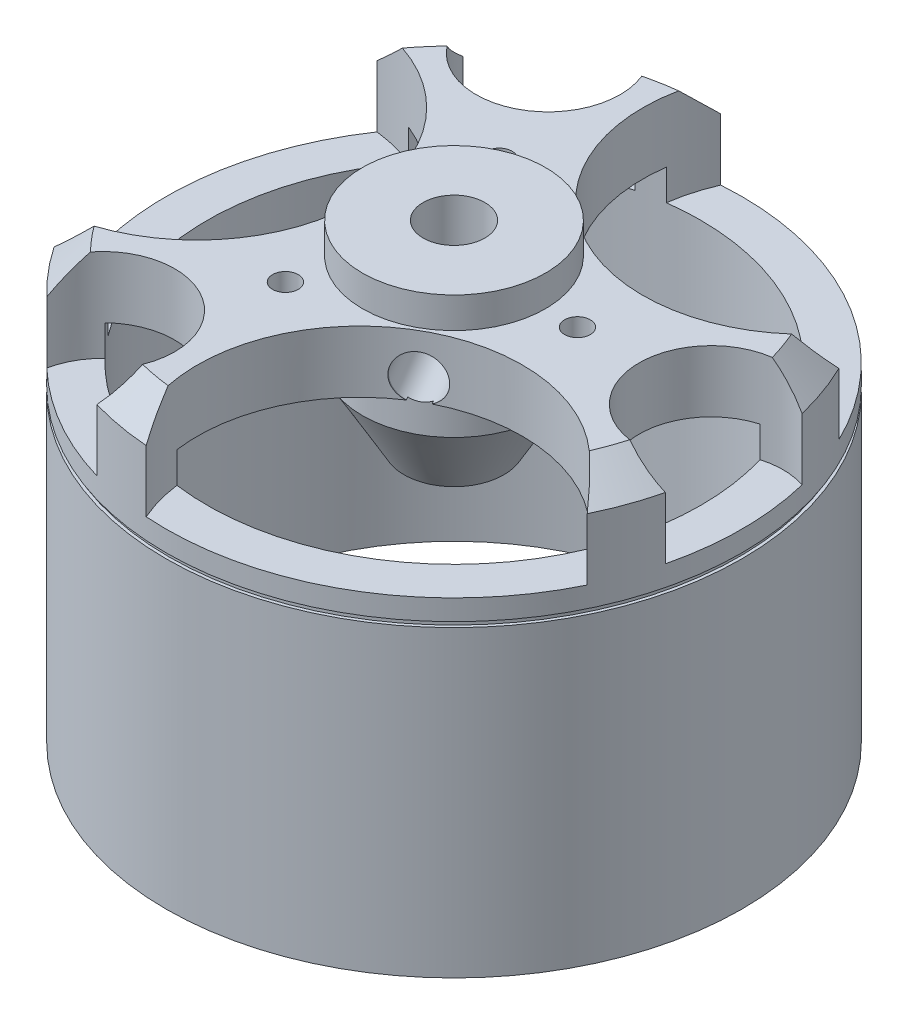
from build123d import *

# Parameters (mm, degrees)
SKETCH1_R                          = 14
BOSS_EXTRUDE1_DEPTH                = 20.5
SKETCH2_R                          = 12
CUT_EXTRUDE1_DEPTH                 = 17.5
CHAMFER1_SIZE                      = 1.5
SKETCH3_W                          = 0.15
SKETCH3_H                          = 0.25
BOSS_EXTRUDE2_DEPTH                = 1.5
BOSS_EXTRUDE2_DEPTH_BACK           = 4.5
SKETCH4_R                          = 4.45
SKETCH10_R                         = 4.45
BOSS_EXTRUDE3_DEPTH                = 3.5
BOSS_EXTRUDE3_TAPER                = 30
SKETCH5_R                          = 1.5
CUT_EXTRUDE2_DEPTH                 = 30.597297174
CUT_EXTRUDE3_START                 = -4.5
CUT_EXTRUDE3_DEPTH                 = 4.5
M1_6X0_35_TAPPED_HOLE1_D           = 1.25
M1_6X0_35_TAPPED_HOLE1_DEPTH       = 4.25
M1_6X0_35_TAPPED_HOLE1_TIP         = 0.375537887
M2_CLEARANCE_HOLE4_D               = 2.2
M2_CLEARANCE_HOLE4_DEPTH           = 3.5
M2_CLEARANCE_HOLE4_TIP             = 0.660946681
M2_CLEARANCE_HOLE4_ON_FACE_2_D     = 2.2
M2_CLEARANCE_HOLE4_ON_FACE_2_DEPTH = 3.5
M2_CLEARANCE_HOLE4_ON_FACE_2_TIP   = 0.660946681


with BuildPart() as part:
    # Sketch1 → Boss-Extrude1 (new body)
    with BuildSketch(Plane(origin=(0, 0, 0), x_dir=(1, 0, 0), z_dir=(0, 1, 0))):
        with Locations(Location((0, 0, 0), (0, 0, 270))):
            Circle(SKETCH1_R)
    extrude(amount=BOSS_EXTRUDE1_DEPTH)

    # Sketch2 → Cut-Extrude1 (cut)
    with BuildSketch(Plane.XZ):
        with Locations(Location((0, 0, 0), (0, 0, 270))):
            Circle(SKETCH2_R)
    extrude(amount=-CUT_EXTRUDE1_DEPTH, mode=Mode.SUBTRACT)

    # Chamfer1
    chamfer1_edges = [part.edges().sort_by_distance(p)[0] for p in [
        (0, 20.5, -14),
    ]]
    chamfer(chamfer1_edges, length=CHAMFER1_SIZE)

    # Sketch3 → Cut-Revolve1 (revolve, cut)
    with BuildSketch(Plane(origin=(0, 0, 0), x_dir=(0, 0, -1), z_dir=(1, 0, 0)), mode=Mode.PRIVATE) as cut_revolve1_sk:
        with Locations((13.925, 14.875)):
            Rectangle(SKETCH3_W, SKETCH3_H)
    revolve(cut_revolve1_sk.sketch.rotate(Axis((0, 20.5, 0), (0, -1, 0)), 180), axis=Axis((0, 20.5, 0), (0, -1, 0)), mode=Mode.SUBTRACT)

    # Sketch4 → Boss-Extrude2 (add, two sides: drawn at the far end of the back side and taken through both)
    with BuildSketch(Plane(origin=(0, 20.5, 0), x_dir=(1, 0, 0), z_dir=(0, 1, 0)).offset(-BOSS_EXTRUDE2_DEPTH_BACK)):
        with Locations(Location((0, 0, 0), (0, 0, 270))):
            Circle(SKETCH4_R)
    extrude(amount=BOSS_EXTRUDE2_DEPTH + BOSS_EXTRUDE2_DEPTH_BACK)

    # Sketch10 → Boss-Extrude3 (add)
    with BuildSketch(Plane.XZ.offset(-16)):
        with Locations(Location((0, 0, 0), (0, 0, 90))):
            Circle(SKETCH10_R)
    extrude(amount=BOSS_EXTRUDE3_DEPTH, taper=BOSS_EXTRUDE3_TAPER)

    # Sketch5 → Cut-Extrude2 (cut, through all)
    with BuildSketch(Plane(origin=(0, 22, 0), x_dir=(1, 0, 0), z_dir=(0, 1, 0))):
        with Locations(Location((0, 0, 0), (0, 0, 270))):
            Circle(SKETCH5_R)
    extrude(amount=-CUT_EXTRUDE2_DEPTH, mode=Mode.SUBTRACT)

    # Sketch6 → Cut-Extrude3 (cut)
    with BuildSketch(Plane(origin=(0, 20.5, 0), x_dir=(1, 0, 0), z_dir=(0, 1, 0)).offset(CUT_EXTRUDE3_START)):
        with BuildLine():
            ThreePointArc((-10.0036, -7.495197598), (-4.6, 0), (-10.0036, 7.495197598))
            ThreePointArc((-10.0036, 7.495197598), (-12.5, 0), (-10.0036, -7.495197598))
        make_face()
        with BuildLine():
            ThreePointArc((-10.0036, 7.495197598), (-10.789488556, 7.712596878), (-11.5936, 7.847830212))
            ThreePointArc((-11.5936, 7.847830212), (-14, 0), (-11.5936, -7.847830212))
            ThreePointArc((-11.5936, -7.847830212), (-10.789488556, -7.712596878), (-10.0036, -7.495197598))
            ThreePointArc((-10.0036, -7.495197598), (-12.5, 0), (-10.0036, 7.495197598))
        make_face()
        with BuildLine():
            ThreePointArc((-9.006237245, -8.668199968), (-6.25, -10.825317547), (-3.003762755, -12.133730231))
            ThreePointArc((-3.003762755, -12.133730231), (-4.5, -7.794228634), (-9.006237245, -8.668199968))
        make_face()
        with BuildLine():
            ThreePointArc((-9.677498914, -10.116620719), (-7, -12.124355653), (-3.922501086, -13.439270264))
            ThreePointArc((-3.922501086, -13.439270264), (-3.387703302, -12.839581088), (-3.003762755, -12.133730231))
            ThreePointArc((-3.003762755, -12.133730231), (-6.25, -10.825317547), (-9.006237245, -8.668199968))
            ThreePointArc((-9.006237245, -8.668199968), (-9.425551745, -9.353627664), (-9.677498914, -10.116620719))
        make_face()
        with BuildLine():
            ThreePointArc((-0.999620328, -13.964267227), (7, -12.124355653), (12.593220328, -6.116437015))
            ThreePointArc((12.593220328, -6.116437015), (12.074049103, -5.487672744), (11.492831527, -4.91577293))
            ThreePointArc((11.492831527, -4.91577293), (6.25, -10.825317547), (-1.489231527, -12.410970529))
            ThreePointArc((-1.489231527, -12.410970529), (-1.284560547, -13.200269622), (-0.999620328, -13.964267227))
        make_face()
        with BuildLine():
            ThreePointArc((-1.489231527, -12.410970529), (6.25, -10.825317547), (11.492831527, -4.91577293))
            ThreePointArc((11.492831527, -4.91577293), (2.3, -3.983716857), (-1.489231527, -12.410970529))
        make_face()
        with BuildLine():
            ThreePointArc((12.5, 0), (12.376893794, 1.75), (12.01, 3.465530262))
            ThreePointArc((12.01, 3.465530262), (9, 0), (12.01, -3.465530262))
            ThreePointArc((12.01, -3.465530262), (12.376893794, -1.75), (12.5, 0))
        make_face()
        with BuildLine():
            ThreePointArc((13.6, -3.322649545), (13.899640283, -1.673320053), (14, 0))
            ThreePointArc((14, 0), (13.899640283, 1.673320053), (13.6, 3.322649545))
            ThreePointArc((13.6, 3.322649545), (12.813255048, 3.485953424), (12.01, 3.465530262))
            ThreePointArc((12.01, 3.465530262), (12.376893794, 1.75), (12.5, 0))
            ThreePointArc((12.5, 0), (12.376893794, -1.75), (12.01, -3.465530262))
            ThreePointArc((12.01, -3.465530262), (12.813255048, -3.485953424), (13.6, -3.322649545))
        make_face()
        with BuildLine():
            ThreePointArc((11.492831527, 4.91577293), (12.074049103, 5.487672744), (12.593220328, 6.116437015))
            ThreePointArc((12.593220328, 6.116437015), (7, 12.124355653), (-0.999620328, 13.964267227))
            ThreePointArc((-0.999620328, 13.964267227), (-1.284560547, 13.200269622), (-1.489231527, 12.410970529))
            ThreePointArc((-1.489231527, 12.410970529), (6.25, 10.825317547), (11.492831527, 4.91577293))
        make_face()
        with BuildLine():
            ThreePointArc((-1.489231527, 12.410970529), (2.3, 3.983716857), (11.492831527, 4.91577293))
            ThreePointArc((11.492831527, 4.91577293), (6.25, 10.825317547), (-1.489231527, 12.410970529))
        make_face()
        with BuildLine():
            ThreePointArc((-9.006237245, 8.668199968), (-4.5, 7.794228634), (-3.003762755, 12.133730231))
            ThreePointArc((-3.003762755, 12.133730231), (-6.25, 10.825317547), (-9.006237245, 8.668199968))
        make_face()
        with BuildLine():
            ThreePointArc((-3.003762755, 12.133730231), (-3.387703302, 12.839581088), (-3.922501086, 13.439270264))
            ThreePointArc((-3.922501086, 13.439270264), (-7, 12.124355653), (-9.677498914, 10.116620719))
            ThreePointArc((-9.677498914, 10.116620719), (-9.425551745, 9.353627664), (-9.006237245, 8.668199968))
            ThreePointArc((-9.006237245, 8.668199968), (-6.25, 10.825317547), (-3.003762755, 12.133730231))
        make_face()
    extrude(amount=CUT_EXTRUDE3_DEPTH, mode=Mode.SUBTRACT)

    # M1.6x0.35 Tapped Hole1
    with Locations(Plane(origin=(6, 20.5, 0), x_dir=(0, 0, 1), z_dir=(0, 1, 0))):
        with Locations((0, 0), (5.196152423, -9), (-5.196152423, -9)):
            Hole(M1_6X0_35_TAPPED_HOLE1_D / 2, depth=M1_6X0_35_TAPPED_HOLE1_DEPTH)
            with Locations((0, 0, -(M1_6X0_35_TAPPED_HOLE1_DEPTH + M1_6X0_35_TAPPED_HOLE1_TIP / 2))):  # 118° drill point
                Cone(0, M1_6X0_35_TAPPED_HOLE1_D / 2, M1_6X0_35_TAPPED_HOLE1_TIP, mode=Mode.SUBTRACT)

    # M2 Clearance Hole4
    with Locations(Plane(origin=(-4.6, 18.5, 0), x_dir=(0, 0, -1), z_dir=(-1, 0, 0))):
        with Locations((0, 0)):
            Hole(M2_CLEARANCE_HOLE4_D / 2, depth=M2_CLEARANCE_HOLE4_DEPTH)
            with Locations((0, 0, -(M2_CLEARANCE_HOLE4_DEPTH + M2_CLEARANCE_HOLE4_TIP / 2))):  # 118° drill point
                Cone(0, M2_CLEARANCE_HOLE4_D / 2, M2_CLEARANCE_HOLE4_TIP, mode=Mode.SUBTRACT)

    # M2 Clearance Hole4 on face 2
    with Locations(Plane(origin=(2.3, 18.5, 3.983716857), x_dir=(0.866025302838, 0, -0.500000174844), z_dir=(0.500000174844, 0, 0.866025302838))):
        with Locations((0, 0)):
            Hole(M2_CLEARANCE_HOLE4_ON_FACE_2_D / 2, depth=M2_CLEARANCE_HOLE4_ON_FACE_2_DEPTH)
            with Locations((0, 0, -(M2_CLEARANCE_HOLE4_ON_FACE_2_DEPTH + M2_CLEARANCE_HOLE4_ON_FACE_2_TIP / 2))):  # 118° drill point
                Cone(0, M2_CLEARANCE_HOLE4_ON_FACE_2_D / 2, M2_CLEARANCE_HOLE4_ON_FACE_2_TIP, mode=Mode.SUBTRACT)


solid = part.part
